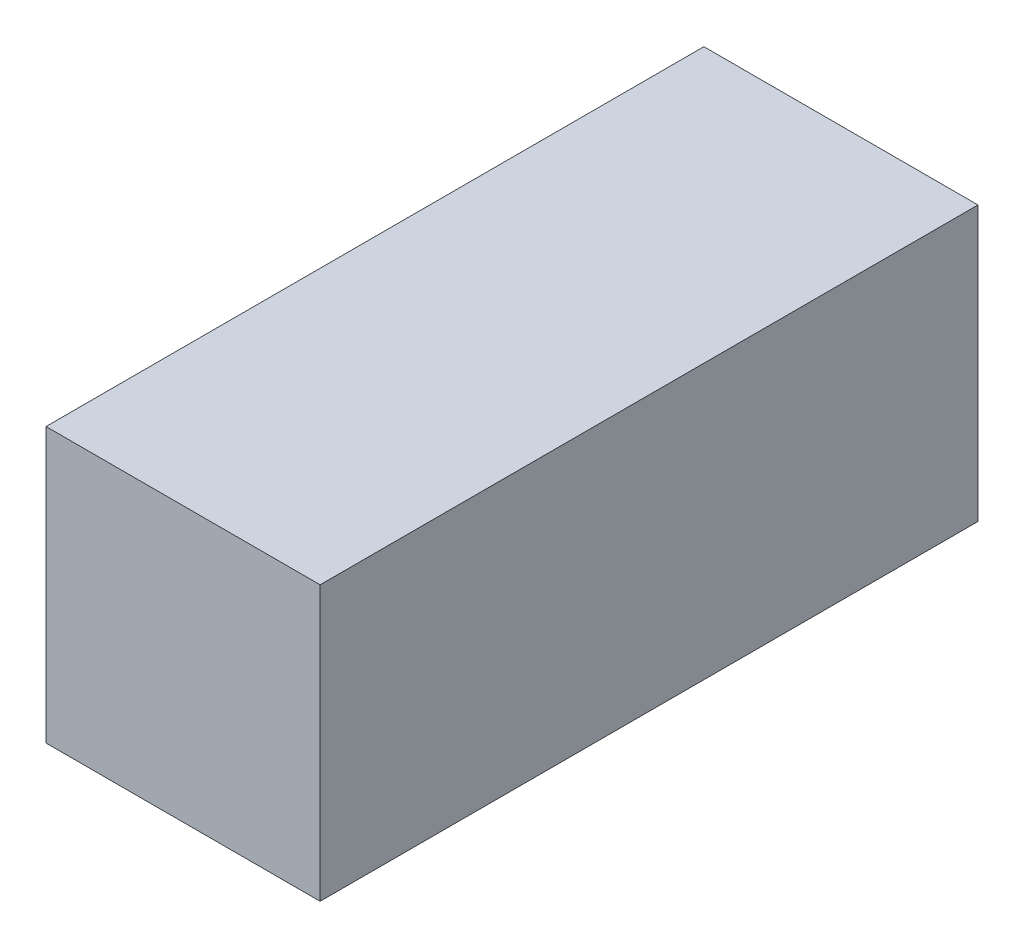
from build123d import *

# Parameters (mm, degrees)
SKETCH1_W           = 254
SKETCH1_H           = 254
BOSS_EXTRUDE1_DEPTH = 609.6


with BuildPart() as part:
    # Sketch1 → Boss-Extrude1 (new body)
    with BuildSketch(Plane.XY):
        Rectangle(SKETCH1_W, SKETCH1_H)
    extrude(amount=BOSS_EXTRUDE1_DEPTH)


solid = part.part
